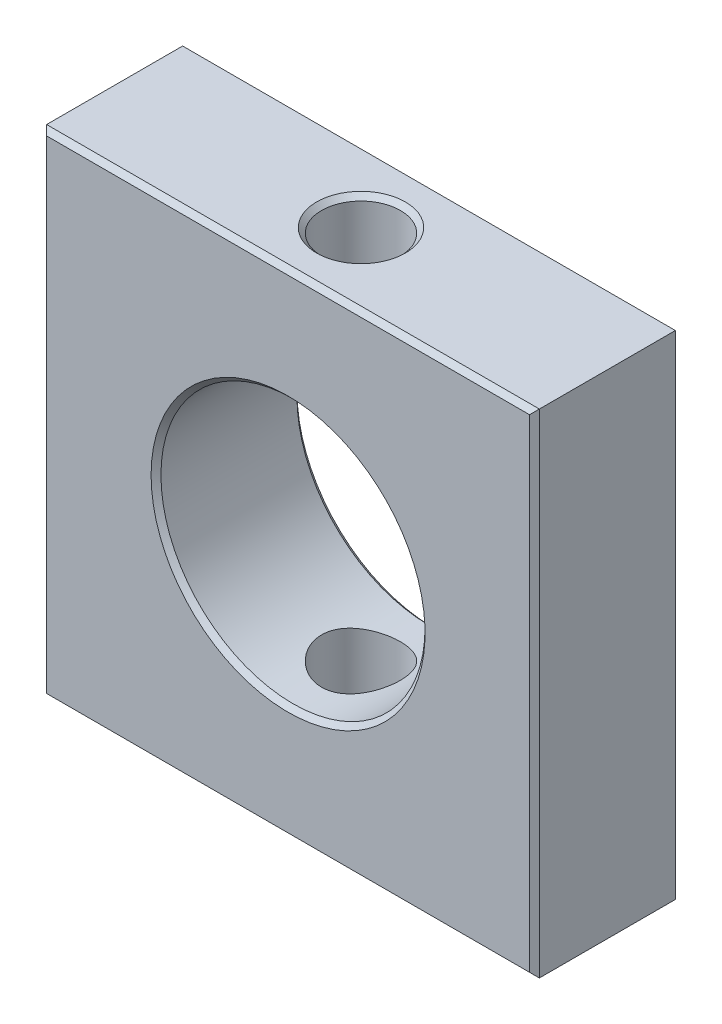
from build123d import *

# Parameters (mm, degrees)
SKETCH1_W               = 25
SKETCH1_H               = 25
SKETCH1_R               = 6.7
BOSS_EXTRUDE1_DEPTH     = 7.4
CUT_EXTRUDE1_DEPTH      = 20.164028804
CUT_EXTRUDE1_DEPTH_BACK = 20.164028804
SKETCH2_R               = 2
CHAMFER1_SIZE           = 0.25


with BuildPart() as part:
    # Sketch1 → Boss-Extrude1 (new body)
    with BuildSketch(Plane.XY):
        Rectangle(SKETCH1_W, SKETCH1_H)
        Circle(SKETCH1_R, mode=Mode.SUBTRACT)
    extrude(amount=BOSS_EXTRUDE1_DEPTH)

    # Sketch2 → Cut-Extrude1 (cut, two sides: drawn at the far end of the back side and taken through both)
    with BuildSketch(Plane(origin=(0, 0, 0), x_dir=(1, 0, 0), z_dir=(0, 1, 0)).offset(-CUT_EXTRUDE1_DEPTH_BACK)):
        with Locations(Location((0, -3.7, 0), (0, 0, 270))):
            Circle(SKETCH2_R)
    extrude(amount=CUT_EXTRUDE1_DEPTH + CUT_EXTRUDE1_DEPTH_BACK, mode=Mode.SUBTRACT)

    # Chamfer1
    chamfer1_edges = [part.edges().sort_by_distance(p)[0] for p in [
        (-6.7, 0, 0),
        (-6.7, 0, 7.4),
        (-12.5, 0, 7.4),
        (0, -12.5, 7.4),
        (0, -12.5, 1.7),
        (0, 12.5, 1.7),
        (12.5, 0, 7.4),
        (0, -12.5, 0),
        (-12.5, 0, 0),
        (0, 12.5, 0),
        (12.5, 0, 0),
        (0, 12.5, 7.4),
    ]]
    chamfer(chamfer1_edges, length=CHAMFER1_SIZE)


solid = part.part
